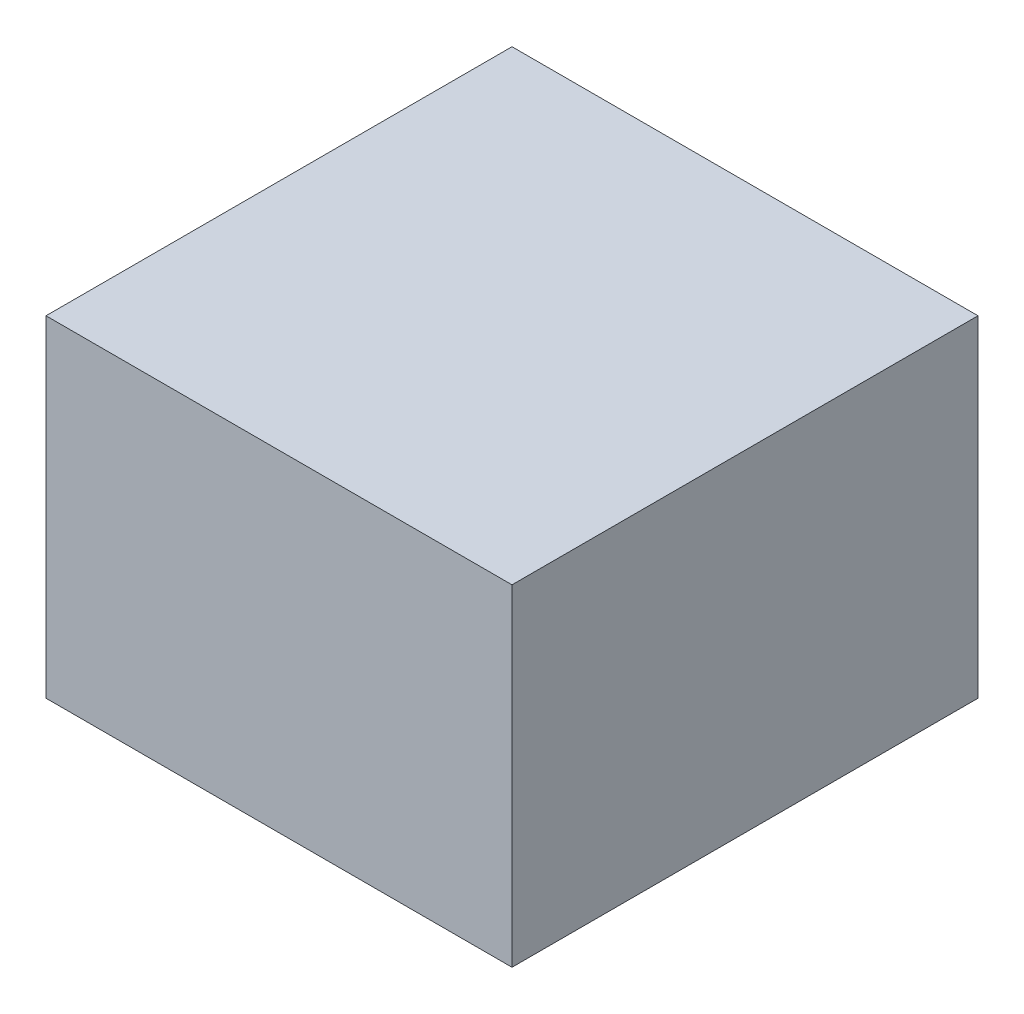
from build123d import *

# Parameters (mm, degrees)
SKETCH_1_W          = 37
SKETCH_1_H          = 37
EXTRUDE_1_DEPTH     = 26.3
SKETCH_2_R          = 1
CUT_EXTRUDE_1_DEPTH = 8


with BuildPart() as part:
    # 草图1 → 凸台-拉伸1 (new body)
    with BuildSketch(Plane(origin=(0, 0, 0), x_dir=(1, 0, 0), z_dir=(0, 1, 0))):
        Rectangle(SKETCH_1_W, SKETCH_1_H)
    extrude(amount=EXTRUDE_1_DEPTH)

    # 草图2 → 切除-拉伸1 (cut)
    with BuildSketch(Plane.XZ):
        with Locations(Location((-14.25, 14.25, 0), (0, 0, 270))):
            Circle(SKETCH_2_R)
        with Locations(Location((14.25, 14.25, 0), (0, 0, 270))):
            Circle(SKETCH_2_R)
        with Locations(Location((14.25, -14.25, 0), (0, 0, 270))):
            Circle(SKETCH_2_R)
        with Locations(Location((-14.25, -14.25, 0), (0, 0, 270))):
            Circle(SKETCH_2_R)
    extrude(amount=-CUT_EXTRUDE_1_DEPTH, mode=Mode.SUBTRACT)


solid = part.part
